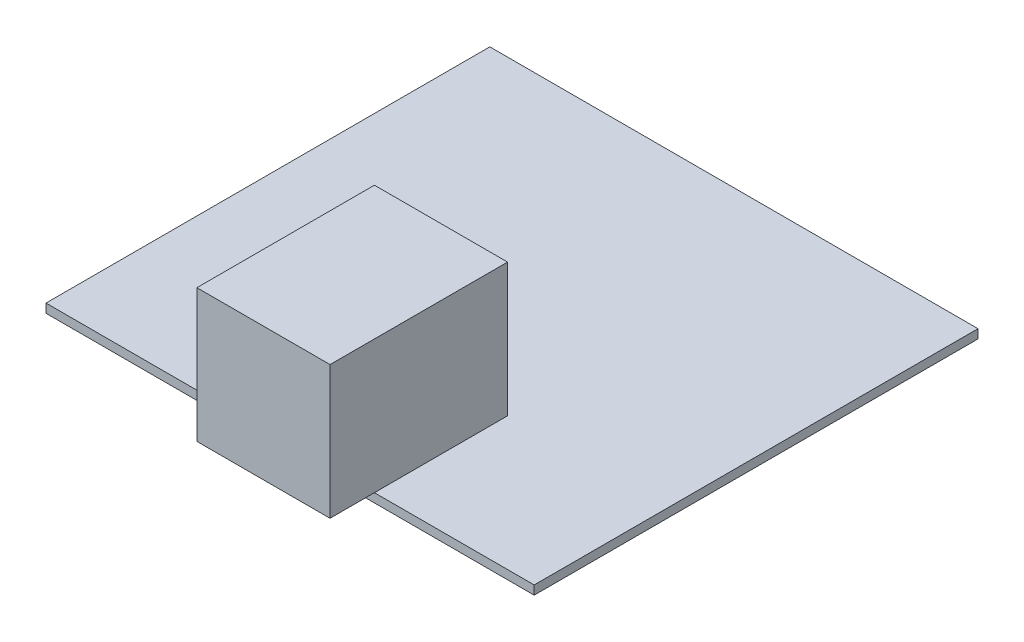
from build123d import *

# Parameters (mm, degrees)
SKETCH_1_W                  = 55
SKETCH_1_H                  = 50
EXTRUDE_1_DEPTH             = 1
SKETCH_2_W                  = 15
SKETCH_2_H                  = 20
EXTRUDE_2_DEPTH             = 15
SKETCH_11_W                 = 43.8
SKETCH_11_H                 = 5
EXTRUDE_7_DEPTH             = 5
SKETCH_12_R                 = 0.2
CUT_EXTRUDE_1_DEPTH         = 5
PATTERN_LINEAR_1_COUNT      = 20
PATTERN_LINEAR_1_PITCH      = 2.2
PATTERN_LINEAR_1_COUNT_DIR2 = 2
PATTERN_LINEAR_1_PITCH_DIR2 = 3


with BuildPart() as part:
    # 草图1 → 凸台-拉伸1 (new body)
    with BuildSketch(Plane(origin=(0, 0, 0), x_dir=(1, 0, 0), z_dir=(0, 1, 0))):
        with Locations((-0.456810631, -5.722591362)):
            Rectangle(SKETCH_1_W, SKETCH_1_H)
    extrude(amount=EXTRUDE_1_DEPTH)

    # 草图2 → 凸台-拉伸2 (add)
    with BuildSketch(Plane(origin=(0, 1, 0), x_dir=(1, 0, 0), z_dir=(0, 1, 0))):
        with Locations((1.543189369, -25.722591362)):
            Rectangle(SKETCH_2_W, SKETCH_2_H)
    extrude(amount=EXTRUDE_2_DEPTH)

    # 草图11 → 凸台-拉伸7 (add)
    with BuildSketch(Plane(origin=(0, 0, 0), x_dir=(-1, 0, 0), z_dir=(0, -1, 0))):
        with Locations((0.551477247, 16.777408638)):
            Rectangle(SKETCH_11_W, SKETCH_11_H)
    extrude(amount=EXTRUDE_7_DEPTH)

    # 草图12 → 切除-拉伸1 (cut)
    with BuildSketch(Plane(origin=(0, -5, 0), x_dir=(-1, 0, 0), z_dir=(0, -1, 0))):
        with Locations(Location((21.451477247, 15.277408638, 0), (0, 0, 90))):
            Circle(SKETCH_12_R)
    cut_extrude_1 = extrude(amount=-CUT_EXTRUDE_1_DEPTH, mode=Mode.SUBTRACT)

    # 阵列(线性)1: Cut-Extrude 1 20 × 2
    with Locations(*[(i * PATTERN_LINEAR_1_PITCH, 0, -j * PATTERN_LINEAR_1_PITCH_DIR2) for i in range(PATTERN_LINEAR_1_COUNT) for j in range(PATTERN_LINEAR_1_COUNT_DIR2) if (i, j) != (0, 0)]):
        add(cut_extrude_1, mode=Mode.SUBTRACT)


solid = part.part
